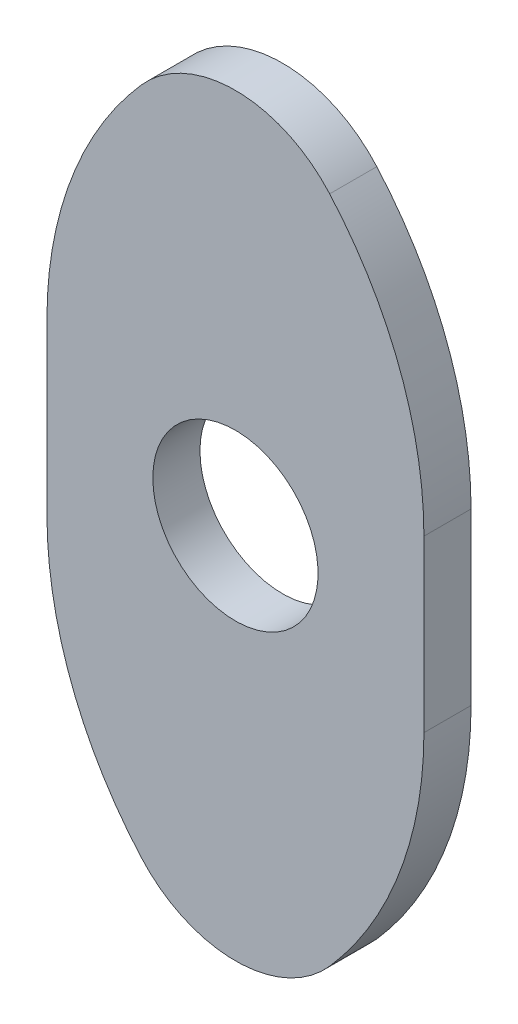
from build123d import *

# Parameters (mm, degrees)
SKETCH1_R          = 8.35025
BASE_EXTRUDE_DEPTH = 4.7625


with BuildPart() as part:
    # Sketch1 → Base-Extrude (new body)
    with BuildSketch(Plane.XY):
        with BuildLine():
            Line((19.05, 8.599479175), (19.05, -8.599479175))
            ThreePointArc((19.05, -8.599479175), (16.589286609, -22.069863356), (9.525, -33.800260413))
            ThreePointArc((9.525, -33.800260413), (0, -38.1), (-9.525, -33.800260413))
            ThreePointArc((-9.525, -33.800260413), (-16.589286609, -22.069863356), (-19.05, -8.599479175))
            Line((-19.05, -8.599479175), (-19.05, 8.599479175))
            ThreePointArc((-19.05, 8.599479175), (-16.589286609, 22.069863356), (-9.525, 33.800260413))
            ThreePointArc((-9.525, 33.800260413), (0, 38.1), (9.525, 33.800260413))
            ThreePointArc((9.525, 33.800260413), (16.589286609, 22.069863356), (19.05, 8.599479175))
        make_face()
        with Locations(Location((0, 0, 0), (0, 0, 180))):
            Circle(SKETCH1_R, mode=Mode.SUBTRACT)
    extrude(amount=BASE_EXTRUDE_DEPTH)


solid = part.part
